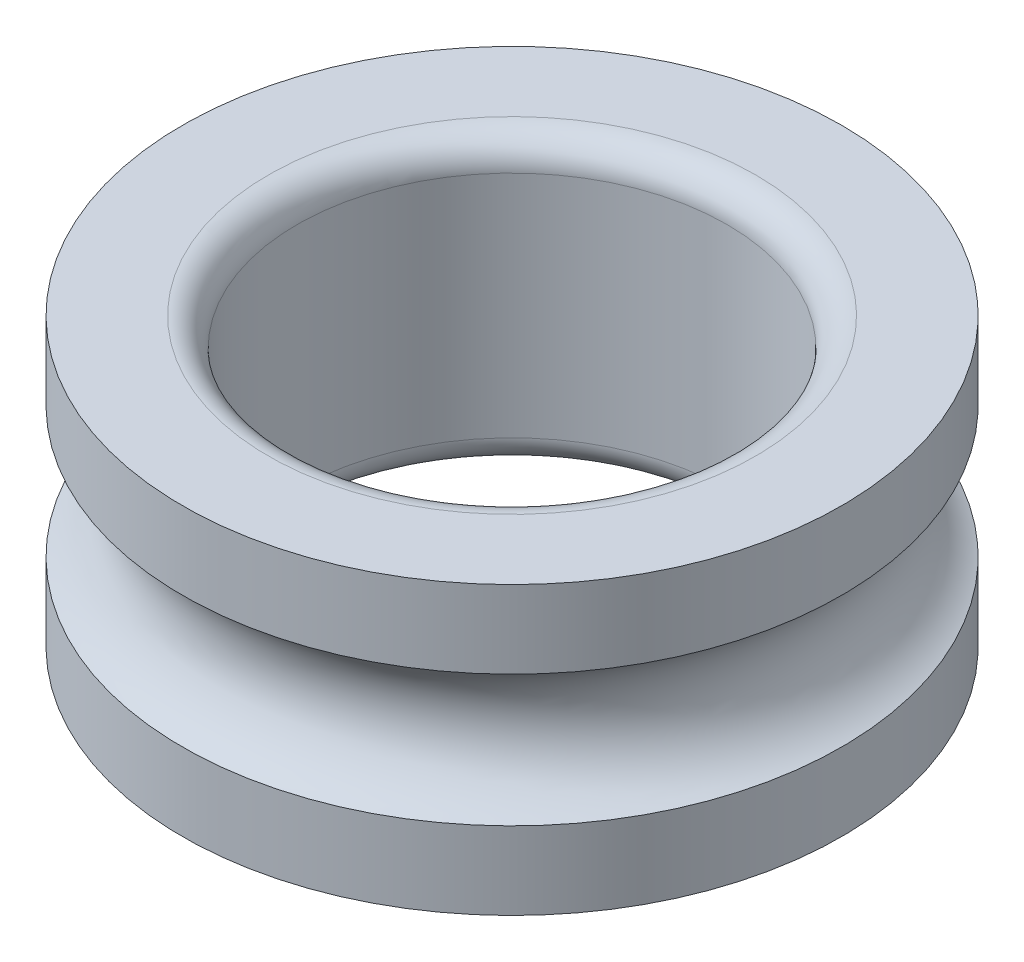
from build123d import *


with BuildPart() as part:
    # Sketch1 → Revolve1 (revolve)
    with BuildSketch(Plane.YZ, mode=Mode.PRIVATE) as revolve1_sk:
        with BuildLine():
            Line((-4, 7.5), (4, 7.5))
            ThreePointArc((4, 7.5), (4.707106781, 7.792893219), (5, 8.5))
            Line((5, 8.5), (5, 11.5))
            Line((5, 11.5), (2.291287847, 11.5))
            ThreePointArc((2.291287847, 11.5), (0, 10), (-2.291287847, 11.5))
            Line((-2.291287847, 11.5), (-5, 11.5))
            Line((-5, 11.5), (-5, 8.5))
            ThreePointArc((-5, 8.5), (-4.707106781, 7.792893219), (-4, 7.5))
        make_face()
    revolve(revolve1_sk.sketch.rotate(Axis((0, -16.256883036, 0), (0, 1, 0)), 180), axis=Axis((0, -16.256883036, 0), (0, 1, 0)))


solid = part.part
